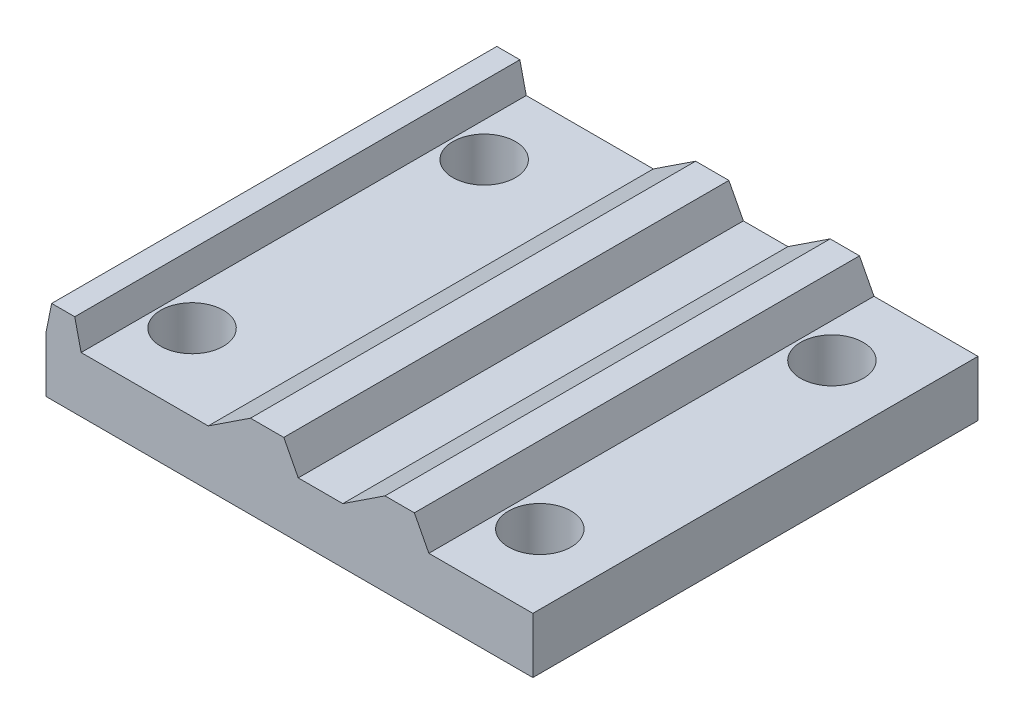
from build123d import *

# Parameters (mm, degrees)
SKETCH_1_W      = 35
SKETCH_1_H      = 32
SKETCH_1_R      = 2.25
EXTRUDE_1_DEPTH = 4
EXTRUDE_2_DEPTH = 32


with BuildPart() as part:
    # 草图1 → 凸台-拉伸1 (new body)
    with BuildSketch(Plane(origin=(0, 0, 0), x_dir=(1, 0, 0), z_dir=(0, 1, 0))):
        Rectangle(SKETCH_1_W, SKETCH_1_H)
        with Locations(Location((-12.5, 10.5, 0), (0, 0, 270))):
            Circle(SKETCH_1_R, mode=Mode.SUBTRACT)
        with Locations(Location((-12.5, -10.5, 0), (0, 0, 90))):
            Circle(SKETCH_1_R, mode=Mode.SUBTRACT)
        with Locations(Location((12.5, -10.5, 0), (0, 0, 270))):
            Circle(SKETCH_1_R, mode=Mode.SUBTRACT)
        with Locations(Location((12.5, 10.5, 0), (0, 0, 90))):
            Circle(SKETCH_1_R, mode=Mode.SUBTRACT)
    extrude(amount=EXTRUDE_1_DEPTH)

    # 草图3 → 凸台-拉伸2 (add)
    with BuildSketch(Plane.XY.offset(16)):
        Polygon((6.872858809, 6), (3.83657923, 4), (10.023141572, 4), (8.981867617, 6), align=None)
        Polygon((-2.800937358, 6), (-5.837216937, 4), (0.634129455, 4), (-0.4071445, 6), align=None)
        Polygon((-17.09182921, 6), (-17.5, 4), (-14.975210984, 4), (-15.433336788, 6), align=None)
    extrude(amount=-EXTRUDE_2_DEPTH)


solid = part.part
